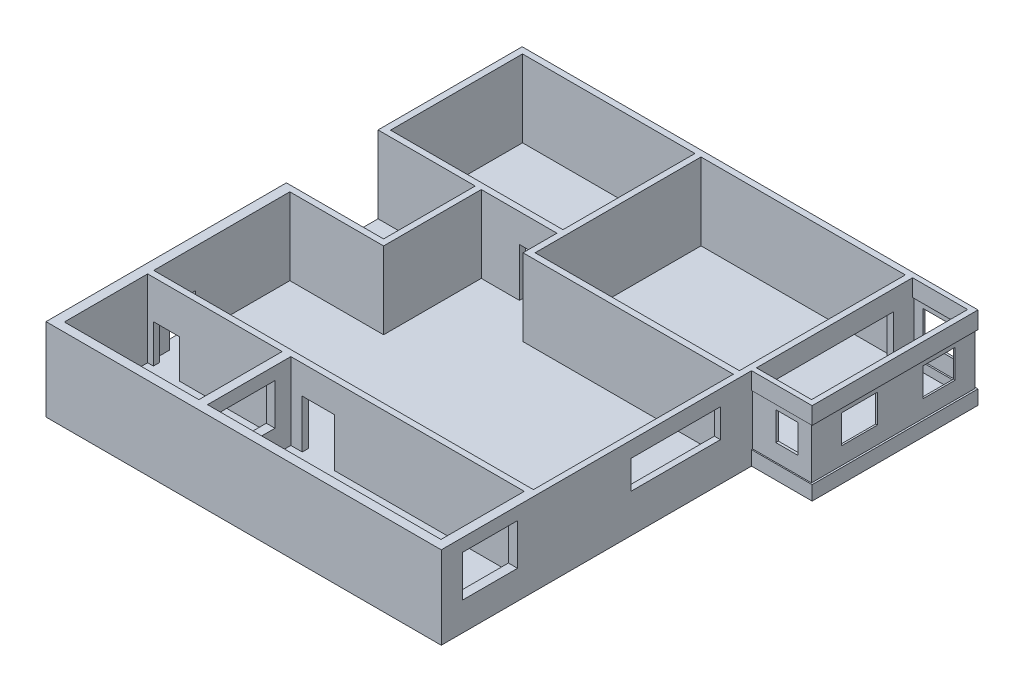
from build123d import *

# Parameters (mm, degrees)
SKETCH_1_W          = 75.913642727
SKETCH_1_H          = 62.446702165
EXTRUDE_1_DEPTH     = 2
EXTRUDE_2_DEPTH     = 27
CUT_EXTRUDE_START   = -7
SKETCH_3_W          = 2.124318213
SKETCH_3_H          = 42.832192033
CUT_EXTRUDE_1_DEPTH = 20
SKETCH_4_W          = 2.124318213
SKETCH_4_H          = 7.801964605
EXTRUDE_3_DEPTH     = 10
SKETCH_5_W          = 75.913642727
SKETCH_5_H          = 72.264822367
EXTRUDE_4_DEPTH     = 2
SKETCH_6_W          = 2.124318213
SKETCH_6_H          = 74.38914058
EXTRUDE_5_DEPTH     = 27
SKETCH_7_W          = 21.257465039
SKETCH_7_H          = 58.185991571
EXTRUDE_6_DEPTH     = 2
EXTRUDE_7_DEPTH     = 3
EXTRUDE_START       = 18
EXTRUDE_8_DEPTH     = 3
EXTRUDE_9_DEPTH     = 3
EXTRUDE_10_DEPTH    = 21
CUT_EXTRUDE_START_2 = -8
SKETCH_12_W         = 10.730208879
SKETCH_12_H         = 1.699417316
SKETCH_12_W_2       = 1.944586737
SKETCH_12_H_2       = 11.195277622
SKETCH_12_H_3       = 12.58207638
SKETCH_12_W_3       = 7.811884166
SKETCH_12_H_4       = 1.726665101
CUT_EXTRUDE_2_DEPTH = 10
CUT_EXTRUDE_START_3 = -5.5
SKETCH_13_W         = 2.124318213
SKETCH_13_H         = 31.292512657
CUT_EXTRUDE_3_DEPTH = 10
SKETCH_14_W         = 73.789324514
SKETCH_14_H         = 2.124318213
EXTRUDE_11_DEPTH    = 27
SKETCH_15_W         = 28.654102471
SKETCH_15_H         = 134.711524532
EXTRUDE_12_DEPTH    = 2
SKETCH_16_W         = 28.654102471
SKETCH_16_H         = 2.124318213
SKETCH_16_W_2       = 26.529784258
EXTRUDE_13_DEPTH    = 27
SKETCH_17_W         = 34.092899776
SKETCH_17_H         = 134.711524532
EXTRUDE_14_DEPTH    = 2
SKETCH_18_W         = 2.255075416
SKETCH_18_H         = 46.30769884
EXTRUDE_15_DEPTH    = 27
SKETCH_19_W         = 7.801964605
SKETCH_19_H         = 7.760030918
CUT_EXTRUDE_4_DEPTH = 17
SKETCH_20_W         = 2.124318213
SKETCH_20_H         = 22.381297739
SKETCH_20_W_2       = 34.092899776
SKETCH_20_H_2       = 2.124318213
EXTRUDE_16_DEPTH    = 27
SKETCH_22_W         = 138.660644974
SKETCH_22_H         = 32.329085963
EXTRUDE_17_DEPTH    = 2
SKETCH_23_W         = 136.536326761
SKETCH_23_H         = 2.124318213
EXTRUDE_18_DEPTH    = 27
CUT_EXTRUDE_START_4 = -27
SKETCH_24_W         = 73.789324514
SKETCH_24_H         = 2.124318213
CUT_EXTRUDE_5_DEPTH = 27
SKETCH_25_W         = 3.039057747
SKETCH_25_H         = 29.223543377
EXTRUDE_19_DEPTH    = 27
CUT_EXTRUDE_START_5 = -4.5
SKETCH_26_W         = 88.139659128
SKETCH_26_H         = 19.232592482
CUT_EXTRUDE_6_DEPTH = 14.5
SKETCH_27_W         = 11.249085033
SKETCH_27_H         = 2.124318213
CUT_EXTRUDE_7_DEPTH = 17
SKETCH_28_W         = 3.329603522
SKETCH_28_H         = 47.759206415
SKETCH_28_H_2       = 31.34786159
EXTRUDE_20_DEPTH    = 27
SKETCH_29_W         = 9.233976249
SKETCH_29_H         = 2.124318213
SKETCH_29_W_2       = 3.329603522
SKETCH_29_H_2       = 9.234531485
CUT_EXTRUDE_8_DEPTH = 13.5


with BuildPart() as part:
    # 草图1 → 凸台-拉伸1 (new body)
    with BuildSketch(Plane(origin=(0, 0, 0), x_dir=(1, 0, 0), z_dir=(0, 1, 0))):
        with Locations((37.956821364, -31.223351083)):
            Rectangle(SKETCH_1_W, SKETCH_1_H)
    extrude(amount=EXTRUDE_1_DEPTH)

    # 草图2 → 凸台-拉伸2 (add)
    with BuildSketch(Plane(origin=(0, 2, 0), x_dir=(1, 0, 0), z_dir=(0, 1, 0))):
        Polygon((0, -62.446702165), (75.913642727, -62.446702165), (75.913642727, 0), (0, 0), (0, -52.520419347), (2.124318213, -52.520419347), (2.124318213, -2.124318213), (73.789324514, -2.124318213), (73.789324514, -60.322383952), (68.344319435, -60.322383952), (0, -60.322383952), align=None)
    extrude(amount=EXTRUDE_2_DEPTH)

    # 草图3 → 切除-拉伸1 (cut)
    with BuildSketch(Plane(origin=(0, 29, 0), x_dir=(1, 0, 0), z_dir=(0, 1, 0)).offset(CUT_EXTRUDE_START)):
        with Locations((74.851483621, -29.879654035)):
            Rectangle(SKETCH_3_W, SKETCH_3_H)
    extrude(amount=-CUT_EXTRUDE_1_DEPTH, mode=Mode.SUBTRACT)

    # 草图4 → 凸台-拉伸3 (add)
    with BuildSketch(Plane(origin=(0, 29, 0), x_dir=(1, 0, 0), z_dir=(0, 1, 0))):
        with Locations((1.062159107, -56.421401649)):
            Rectangle(SKETCH_4_W, SKETCH_4_H)
    extrude(amount=-EXTRUDE_3_DEPTH)

    # 草图5 → 凸台-拉伸4 (add)
    with BuildSketch(Plane.XZ):
        with Locations((37.956821364, 98.579113349)):
            Rectangle(SKETCH_5_W, SKETCH_5_H)
    extrude(amount=-EXTRUDE_4_DEPTH)

    # 草图6 → 凸台-拉伸5 (add)
    with BuildSketch(Plane(origin=(0, 2, 0), x_dir=(1, 0, 0), z_dir=(0, 1, 0))):
        with Locations((74.851483621, -97.516954242)):
            Rectangle(SKETCH_6_W, SKETCH_6_H)
    extrude(amount=EXTRUDE_5_DEPTH)

    # 草图7 → 凸台-拉伸6 (add)
    with BuildSketch(Plane.XZ):
        with Locations((86.542375247, 29.092995786)):
            Rectangle(SKETCH_7_W, SKETCH_7_H)
    extrude(amount=-EXTRUDE_6_DEPTH)

    # 草图8 → 凸台-拉伸7 (add)
    with BuildSketch(Plane(origin=(0, 2, 0), x_dir=(1, 0, 0), z_dir=(0, 1, 0))):
        Polygon((75.913642727, -58.185991571), (75.913642727, -56.45932647), (95.226521029, -56.45932647), (95.226521029, -1.699417316), (75.913642727, -1.699417316), (75.913642727, 0), (97.171107766, 0), (97.171107766, -58.185991571), align=None)
    extrude(amount=EXTRUDE_7_DEPTH)

    # 草图9 → 凸台-拉伸8 (add)
    with BuildSketch(Plane(origin=(0, 5, 0), x_dir=(1, 0, 0), z_dir=(0, 1, 0)).offset(EXTRUDE_START)):
        Polygon((75.913642727, -58.185991571), (97.171107766, -58.185991571), (97.171107766, 0), (75.913642727, 0), (75.913642727, -1.699417316), (95.226521029, -1.699417316), (95.226521029, -56.45932647), (75.913642727, -56.45932647), align=None)
    extrude(amount=EXTRUDE_8_DEPTH)

    # 草图10 → 凸台-拉伸9 (add)
    with BuildSketch(Plane(origin=(0, 26, 0), x_dir=(1, 0, 0), z_dir=(0, 1, 0))):
        Polygon((75.913642727, -56.45932647), (75.913642727, -58.185991571), (97.171107766, -58.185991571), (97.171107766, 0), (75.913642727, 0), (75.913642727, -1.699417316), (95.226521029, -1.699417316), (95.226521029, -56.45932647), align=None)
    extrude(amount=EXTRUDE_9_DEPTH)

    # 草图11 → 凸台-拉伸10 (add)
    with BuildSketch(Plane(origin=(0, 5, 0), x_dir=(1, 0, 0), z_dir=(0, 1, 0))):
        Polygon((75.913642727, -56.879985146), (75.913642727, -57.767002905), (96.519280812, -57.767002905), (96.519280812, -0.469783288), (75.913642727, -0.469783288), (75.913642727, -1.183025895), (95.892442802, -1.183025895), (95.892442802, -56.879985146), align=None)
    extrude(amount=EXTRUDE_10_DEPTH)

    # 草图12 → 切除-拉伸2 (cut)
    with BuildSketch(Plane(origin=(0, 29, 0), x_dir=(1, 0, 0), z_dir=(0, 1, 0)).offset(CUT_EXTRUDE_START_2)):
        with Locations((84.386634544, -0.849708658)):
            Rectangle(SKETCH_12_W, SKETCH_12_H)
        with Locations((96.198814398, -12.98486795)):
            Rectangle(SKETCH_12_W_2, SKETCH_12_H_2)
        with Locations((96.198814398, -40.926726277)):
            Rectangle(SKETCH_12_W_2, SKETCH_12_H_3)
        with Locations((87.905733133, -57.32265902)):
            Rectangle(SKETCH_12_W_3, SKETCH_12_H_4)
    extrude(amount=-CUT_EXTRUDE_2_DEPTH, mode=Mode.SUBTRACT)

    # 草图13 → 切除-拉伸3 (cut)
    with BuildSketch(Plane(origin=(0, 29, 0), x_dir=(1, 0, 0), z_dir=(0, 1, 0)).offset(CUT_EXTRUDE_START_3)):
        with Locations((74.851483621, -84.761912061)):
            Rectangle(SKETCH_13_W, SKETCH_13_H)
    extrude(amount=-CUT_EXTRUDE_3_DEPTH, mode=Mode.SUBTRACT)

    # 草图14 → 凸台-拉伸11 (add)
    with BuildSketch(Plane(origin=(0, 2, 0), x_dir=(1, 0, 0), z_dir=(0, 1, 0))):
        with Locations((36.894662257, -106.023590927)):
            Rectangle(SKETCH_14_W, SKETCH_14_H)
    extrude(amount=EXTRUDE_11_DEPTH)

    # 草图15 → 凸台-拉伸12 (add)
    with BuildSketch(Plane.XZ):
        with Locations((-14.327051236, 67.355762266)):
            Rectangle(SKETCH_15_W, SKETCH_15_H)
    extrude(amount=-EXTRUDE_12_DEPTH)

    # 草图16 → 凸台-拉伸13 (add)
    with BuildSketch(Plane(origin=(0, 2, 0), x_dir=(1, 0, 0), z_dir=(0, 1, 0))):
        with Locations((-14.327051236, -1.062159107)):
            Rectangle(SKETCH_16_W, SKETCH_16_H)
        with Locations((-13.264892129, -49.49417616)):
            Rectangle(SKETCH_16_W_2, SKETCH_16_H)
        Polygon((-28.654102471, -62.446702165), (-26.529784258, -62.446702165), (-26.529784258, -50.556335266), (-26.529784258, -48.432017053), (-28.654102471, -48.432017053), align=None)
    extrude(amount=EXTRUDE_13_DEPTH)

    # 草图17 → 凸台-拉伸14 (add)
    with BuildSketch(Plane.XZ):
        with Locations((-45.700552359, 67.355762266)):
            Rectangle(SKETCH_17_W, SKETCH_17_H)
    extrude(amount=-EXTRUDE_14_DEPTH)

    # 草图18 → 凸台-拉伸15 (add)
    with BuildSketch(Plane(origin=(0, 2, 0), x_dir=(1, 0, 0), z_dir=(0, 1, 0))):
        Polygon((-60.491926831, -2.124318213), (-28.654102471, -2.124318213), (-28.654102471, 0), (-62.747002247, 0), (-62.747002247, -2.124318213), align=None)
        with Locations((-61.619464539, -25.278167633)):
            Rectangle(SKETCH_18_W, SKETCH_18_H)
        Polygon((-26.529784258, -48.432017053), (-60.491926831, -48.432017053), (-62.747002247, -48.432017053), (-62.747002247, -50.556335266), (-26.529784258, -50.556335266), align=None)
    extrude(amount=EXTRUDE_15_DEPTH)

    # 草图19 → 切除-拉伸4 (cut)
    with BuildSketch(Plane.XZ.offset(-19)):
        with Locations((-9.25141008, 48.683171807)):
            Rectangle(SKETCH_19_W, SKETCH_19_H)
    extrude(amount=CUT_EXTRUDE_4_DEPTH, mode=Mode.SUBTRACT)

    # 草图20 → 凸台-拉伸16 (add)
    with BuildSketch(Plane(origin=(0, 2, 0), x_dir=(1, 0, 0), z_dir=(0, 1, 0))):
        with Locations((-27.591943365, -73.637351034)):
            Rectangle(SKETCH_20_W, SKETCH_20_H)
        with Locations((-45.700552359, -83.765840798)):
            Rectangle(SKETCH_20_W_2, SKETCH_20_H_2)
    extrude(amount=EXTRUDE_16_DEPTH)

    # 草图22 → 凸台-拉伸17 (add)
    with BuildSketch(Plane.XZ):
        with Locations((6.58332024, 150.876067514)):
            Rectangle(SKETCH_22_W, SKETCH_22_H)
    extrude(amount=-EXTRUDE_17_DEPTH)

    # 草图23 → 凸台-拉伸18 (add)
    with BuildSketch(Plane(origin=(0, 2, 0), x_dir=(1, 0, 0), z_dir=(0, 1, 0))):
        with Locations((5.521161133, -133.649365426)):
            Rectangle(SKETCH_23_W, SKETCH_23_H)
    extrude(amount=EXTRUDE_18_DEPTH)

    # 草图24 → 切除-拉伸5 (cut)
    with BuildSketch(Plane(origin=(0, 29, 0), x_dir=(1, 0, 0), z_dir=(0, 1, 0)).offset(CUT_EXTRUDE_START_4)):
        with Locations((36.894662257, -106.023590927)):
            Rectangle(SKETCH_24_W, SKETCH_24_H)
    extrude(amount=CUT_EXTRUDE_5_DEPTH, mode=Mode.SUBTRACT)

    # 草图25 → 凸台-拉伸19 (add)
    with BuildSketch(Plane(origin=(0, 2, 0), x_dir=(1, 0, 0), z_dir=(0, 1, 0))):
        Polygon((75.913642727, -167.040610495), (75.913642727, -134.711524532), (72.710667325, -134.711524532), (72.710667325, -163.935067909), (72.710667325, -167.040610495), align=None)
        Polygon((72.710667325, -167.040610495), (72.710667325, -163.935067909), (-9.186958654, -163.935067909), (-12.226016401, -163.935067909), (-62.747002247, -163.935067909), (-62.747002247, -167.040610495), align=None)
        with Locations((-10.706487528, -149.32329622)):
            Rectangle(SKETCH_25_W, SKETCH_25_H)
    extrude(amount=EXTRUDE_19_DEPTH)

    # 草图26 → 切除-拉伸6 (cut)
    with BuildSketch(Plane(origin=(0, 29, 0), x_dir=(1, 0, 0), z_dir=(0, 1, 0)).offset(CUT_EXTRUDE_START_5)):
        with Locations((31.843813163, -149.88949865)):
            Rectangle(SKETCH_26_W, SKETCH_26_H)
    extrude(amount=-CUT_EXTRUDE_6_DEPTH, mode=Mode.SUBTRACT)

    # 草图27 → 切除-拉伸7 (cut)
    with BuildSketch(Plane(origin=(0, 29, 0), x_dir=(1, 0, 0), z_dir=(0, 1, 0)).offset(CUT_EXTRUDE_START_4)):
        with Locations((0.435624052, -133.649365426)):
            Rectangle(SKETCH_27_W, SKETCH_27_H)
    extrude(amount=CUT_EXTRUDE_7_DEPTH, mode=Mode.SUBTRACT)

    # 草图28 → 凸台-拉伸20 (add)
    with BuildSketch(Plane(origin=(0, 2, 0), x_dir=(1, 0, 0), z_dir=(0, 1, 0))):
        with Locations((-61.082200486, -108.707603112)):
            Rectangle(SKETCH_28_W, SKETCH_28_H)
        with Locations((-61.082200486, -148.261137114)):
            Rectangle(SKETCH_28_W, SKETCH_28_H_2)
    extrude(amount=EXTRUDE_20_DEPTH)

    # 草图29 → 切除-拉伸8 (cut)
    with BuildSketch(Plane(origin=(0, 29, 0), x_dir=(1, 0, 0), z_dir=(0, 1, 0)).offset(CUT_EXTRUDE_START_4)):
        with Locations((-52.783158211, -133.649365426)):
            Rectangle(SKETCH_29_W, SKETCH_29_H)
        with Locations((-61.082200486, -122.464998081)):
            Rectangle(SKETCH_29_W_2, SKETCH_29_H_2)
    extrude(amount=CUT_EXTRUDE_8_DEPTH, mode=Mode.SUBTRACT)


solid = part.part
